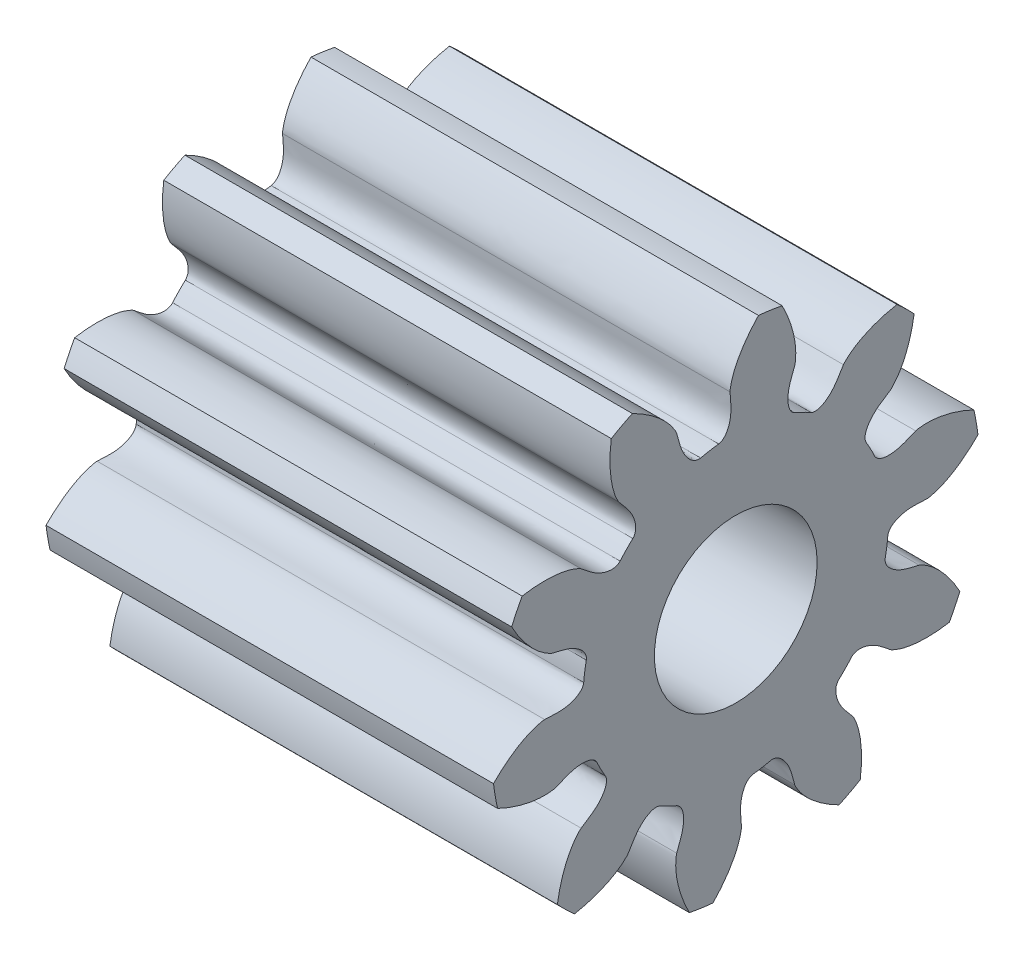
from build123d import *

# Parameters (mm, degrees)
ESQUISSE1_R        = 1
BOSS_EXTRU_1_DEPTH = 5.5


with BuildPart() as part:
    # Esquisse1 → Boss.-Extru.1 (new body)
    with BuildSketch(Plane(origin=(0, 0, 0), x_dir=(0, 0, -1), z_dir=(1, 0, 0))):
        with BuildLine():
            ThreePointArc((2.977310095, 0.368272455), (2.955741127, 0.513414445), (2.927100903, 0.657328154))
            add(Edge.make_bspline(
                [(2.211403727, 0.79214554), (2.222779445, 0.796220429), (2.274133198, 0.805614359), (2.359373738, 0.810478726), (2.538607422, 0.796225963), (2.732062921, 0.744216047), (2.878239296, 0.681280138), (2.927100903, 0.657328154)],
                knots=[0, 0, 0, 0, 0.036250587, 0.155621312, 0.255291203, 0.575254513, 0.744084786, 0.744084786, 0.744084786, 0.744084786], degree=3))
            add(Edge.make_bspline(
                [(2.211403727, 0.79214554), (2.132130324, 0.763749064), (1.99001212, 0.681956821), (1.750090704, 0.694113528), (1.707279056, 0.775127876)],
                knots=[0, 0, 0, 0, 0.252617676, 0.527509393, 0.527509393, 0.527509393, 0.527509393], degree=3))
            ThreePointArc((1.707279056, 0.775127876), (1.657764419, 0.876037746), (1.602292085, 0.973799299))
            add(Edge.make_bspline(
                [(1.90038092, 1.380707558), (1.832256922, 1.331212576), (1.684611138, 1.259880414), (1.559480437, 1.054813647), (1.602292085, 0.973799299)],
                knots=[0, 0, 0, 0, 0.252617676, 0.527509393, 0.527509393, 0.527509393, 0.527509393], degree=3))
            add(Edge.make_bspline(
                [(1.90038092, 1.380707558), (1.9101567, 1.387810078), (1.946851003, 1.424944725), (1.998895263, 1.49262786), (2.088102134, 1.648736761), (2.154127637, 1.837868182), (2.184488772, 1.994094501), (2.192229346, 2.04795764)],
                knots=[0, 0, 0, 0, 0.036250587, 0.155621312, 0.255291203, 0.575254513, 0.744084786, 0.744084786, 0.744084786, 0.744084786], degree=3))
            ThreePointArc((2.192229346, 2.04795764), (2.089467363, 2.152702055), (1.98170658, 2.25229639))
            add(Edge.make_bspline(
                [(1.32345173, 1.940689701), (1.33025972, 1.950672835), (1.366284165, 1.988457663), (1.432386008, 2.04249615), (1.585766668, 2.136316339), (1.772846116, 2.207949723), (1.928098087, 2.242953821), (1.98170658, 2.25229639)],
                knots=[0, 0, 0, 0, 0.036250587, 0.155621312, 0.255291203, 0.575254513, 0.744084786, 0.744084786, 0.744084786, 0.744084786], degree=3))
            add(Edge.make_bspline(
                [(1.32345173, 1.940689701), (1.27600923, 1.871120733), (1.209109462, 1.721414433), (1.007863426, 1.590227146), (0.925609036, 1.630605075)],
                knots=[0, 0, 0, 0, 0.252617676, 0.527509393, 0.527509393, 0.527509393, 0.527509393], degree=3))
            ThreePointArc((0.925609036, 1.630605075), (0.82623752, 1.683138901), (0.72389666, 1.729623839))
            add(Edge.make_bspline(
                [(0.72588092, 2.234031757), (0.699859868, 2.153947194), (0.622339913, 2.009454248), (0.641642271, 1.770001768), (0.72389666, 1.729623839)],
                knots=[0, 0, 0, 0, 0.252617676, 0.527509393, 0.527509393, 0.527509393, 0.527509393], degree=3))
            add(Edge.make_bspline(
                [(0.72588092, 2.234031757), (0.729614936, 2.245523876), (0.737474053, 2.297134806), (0.739795594, 2.382482461), (0.720206959, 2.561211698), (0.662454053, 2.753031049), (0.595189201, 2.897266624), (0.569791499, 2.945392614)],
                knots=[0, 0, 0, 0, 0.036250587, 0.155621312, 0.255291203, 0.575254513, 0.744084786, 0.744084786, 0.744084786, 0.744084786], degree=3))
            ThreePointArc((0.569791499, 2.945392614), (0.425088085, 2.969730648), (0.279367699, 2.986963958))
            add(Edge.make_bspline(
                [(-0.070013845, 2.347956359), (-0.070374004, 2.360034519), (-0.063438981, 2.411777724), (-0.041724492, 2.494349468), (0.027216945, 2.660406485), (0.136462351, 2.82832165), (0.241488941, 2.947895379), (0.279367699, 2.986963958)],
                knots=[0, 0, 0, 0, 0.036250587, 0.155621312, 0.255291203, 0.575254513, 0.744084786, 0.744084786, 0.744084786, 0.744084786], degree=3))
            add(Edge.make_bspline(
                [(-0.070013845, 2.347956359), (-0.06750402, 2.263787878), (-0.033631914, 2.103350241), (-0.119333425, 1.878928045), (-0.209612175, 1.863246558)],
                knots=[0, 0, 0, 0, 0.252617676, 0.527509393, 0.527509393, 0.527509393, 0.527509393], degree=3))
            ThreePointArc((-0.209612175, 1.863246558), (-0.320884028, 1.847338204), (-0.431002684, 1.824790861))
            add(Edge.make_bspline(
                [(-0.72588092, 2.234031757), (-0.699859868, 2.153947194), (-0.677644007, 1.991484859), (-0.521281435, 1.809109374), (-0.431002684, 1.824790861)],
                knots=[0, 0, 0, 0, 0.252617676, 0.527509393, 0.527509393, 0.527509393, 0.527509393], degree=3))
            add(Edge.make_bspline(
                [(-0.72588092, 2.234031757), (-0.729614936, 2.245523876), (-0.75359292, 2.291897469), (-0.801880846, 2.36230974), (-0.922782795, 2.495390819), (-1.082254463, 2.616629628), (-1.221452415, 2.693781371), (-1.270287335, 2.717787719)],
                knots=[0, 0, 0, 0, 0.036250587, 0.155621312, 0.255291203, 0.575254513, 0.744084786, 0.744084786, 0.744084786, 0.744084786], degree=3))
            ThreePointArc((-1.270287335, 2.717787719), (-1.401660393, 2.65242307), (-1.529680147, 2.580712818))
            add(Edge.make_bspline(
                [(-1.436736511, 1.858383491), (-1.44412725, 1.867943232), (-1.468930592, 1.913880668), (-1.499897654, 1.993446068), (-1.541728726, 2.168311777), (-1.552045394, 2.368370838), (-1.537360771, 2.526841097), (-1.529680147, 2.580712818)],
                knots=[0, 0, 0, 0, 0.036250587, 0.155621312, 0.255291203, 0.575254513, 0.744084786, 0.744084786, 0.744084786, 0.744084786], degree=3))
            add(Edge.make_bspline(
                [(-1.436736511, 1.858383491), (-1.385233029, 1.791764998), (-1.263527042, 1.681877747), (-1.200948963, 1.449942292), (-1.26476866, 1.384191185)],
                knots=[0, 0, 0, 0, 0.252617676, 0.527509393, 0.527509393, 0.527509393, 0.527509393], degree=3))
            ThreePointArc((-1.26476866, 1.384191185), (-1.345438785, 1.305917102), (-1.421273653, 1.222949796))
            add(Edge.make_bspline(
                [(-1.90038092, 1.380707558), (-1.832256922, 1.331212576), (-1.718790948, 1.212835941), (-1.48509335, 1.157198689), (-1.421273653, 1.222949796)],
                knots=[0, 0, 0, 0, 0.252617676, 0.527509393, 0.527509393, 0.527509393, 0.527509393], degree=3))
            add(Edge.make_bspline(
                [(-1.90038092, 1.380707558), (-1.9101567, 1.387810078), (-1.956813011, 1.411233197), (-2.037266059, 1.43981499), (-2.213300886, 1.476415463), (-2.413578559, 1.480764624), (-2.571540724, 1.461363192), (-2.625159582, 1.45208029)],
                knots=[0, 0, 0, 0, 0.036250587, 0.155621312, 0.255291203, 0.575254513, 0.744084786, 0.744084786, 0.744084786, 0.744084786], degree=3))
            ThreePointArc((-2.625159582, 1.45208029), (-2.693022242, 1.321980032), (-2.75444217, 1.188717096))
            add(Edge.make_bspline(
                [(-2.254674663, 0.658971294), (-2.266272971, 0.662361119), (-2.313340644, 0.684946248), (-2.385160892, 0.731114025), (-2.521786425, 0.847995669), (-2.64772455, 1.003782864), (-2.728990923, 1.140619401), (-2.75444217, 1.188717096)],
                knots=[0, 0, 0, 0, 0.036250587, 0.155621312, 0.255291203, 0.575254513, 0.744084786, 0.744084786, 0.744084786, 0.744084786], degree=3))
            add(Edge.make_bspline(
                [(-2.254674663, 0.658971294), (-2.173850103, 0.635348788), (-2.010797786, 0.617985118), (-1.823842817, 0.467127866), (-1.836826505, 0.376421826)],
                knots=[0, 0, 0, 0, 0.252617676, 0.527509393, 0.527509393, 0.527509393, 0.527509393], degree=3))
            ThreePointArc((-1.836826505, 0.376421826), (-1.856081655, 0.265680053), (-1.868666393, 0.153983476))
            add(Edge.make_bspline(
                [(-2.349, 0), (-2.264794108, 0), (-2.103418166, -0.029075083), (-1.881650081, 0.063277436), (-1.868666393, 0.153983476)],
                knots=[0, 0, 0, 0, 0.252617676, 0.527509393, 0.527509393, 0.527509393, 0.527509393], degree=3))
            add(Edge.make_bspline(
                [(-2.349, 0), (-2.361083529, 0), (-2.412597041, -0.00847419), (-2.494484881, -0.032640149), (-2.658413265, -0.106500419), (-2.822997679, -0.220702136), (-2.93938788, -0.329246056), (-2.977310095, -0.368272455)],
                knots=[0, 0, 0, 0, 0.036250587, 0.155621312, 0.255291203, 0.575254513, 0.744084786, 0.744084786, 0.744084786, 0.744084786], degree=3))
            ThreePointArc((-2.977310095, -0.368272455), (-2.955741127, -0.513414445), (-2.927100903, -0.657328154))
            add(Edge.make_bspline(
                [(-2.211403727, -0.79214554), (-2.222779445, -0.796220429), (-2.274133198, -0.805614359), (-2.359373738, -0.810478726), (-2.538607422, -0.796225963), (-2.732062921, -0.744216047), (-2.878239296, -0.681280138), (-2.927100903, -0.657328154)],
                knots=[0, 0, 0, 0, 0.036250587, 0.155621312, 0.255291203, 0.575254513, 0.744084786, 0.744084786, 0.744084786, 0.744084786], degree=3))
            add(Edge.make_bspline(
                [(-2.211403727, -0.79214554), (-2.132130324, -0.763749064), (-1.99001212, -0.681956821), (-1.750090704, -0.694113528), (-1.707279056, -0.775127876)],
                knots=[0, 0, 0, 0, 0.252617676, 0.527509393, 0.527509393, 0.527509393, 0.527509393], degree=3))
            ThreePointArc((-1.707279056, -0.775127876), (-1.657764419, -0.876037746), (-1.602292085, -0.973799299))
            add(Edge.make_bspline(
                [(-1.90038092, -1.380707558), (-1.832256922, -1.331212576), (-1.684611138, -1.259880414), (-1.559480437, -1.054813647), (-1.602292085, -0.973799299)],
                knots=[0, 0, 0, 0, 0.252617676, 0.527509393, 0.527509393, 0.527509393, 0.527509393], degree=3))
            add(Edge.make_bspline(
                [(-1.90038092, -1.380707558), (-1.9101567, -1.387810078), (-1.946851003, -1.424944725), (-1.998895263, -1.49262786), (-2.088102134, -1.648736761), (-2.154127637, -1.837868182), (-2.184488772, -1.994094501), (-2.192229346, -2.04795764)],
                knots=[0, 0, 0, 0, 0.036250587, 0.155621312, 0.255291203, 0.575254513, 0.744084786, 0.744084786, 0.744084786, 0.744084786], degree=3))
            ThreePointArc((-2.192229346, -2.04795764), (-2.089467363, -2.152702055), (-1.98170658, -2.25229639))
            add(Edge.make_bspline(
                [(-1.32345173, -1.940689701), (-1.33025972, -1.950672835), (-1.366284165, -1.988457663), (-1.432386008, -2.04249615), (-1.585766668, -2.136316339), (-1.772846116, -2.207949723), (-1.928098087, -2.242953821), (-1.98170658, -2.25229639)],
                knots=[0, 0, 0, 0, 0.036250587, 0.155621312, 0.255291203, 0.575254513, 0.744084786, 0.744084786, 0.744084786, 0.744084786], degree=3))
            add(Edge.make_bspline(
                [(-1.32345173, -1.940689701), (-1.27600923, -1.871120733), (-1.209109462, -1.721414433), (-1.007863426, -1.590227146), (-0.925609036, -1.630605075)],
                knots=[0, 0, 0, 0, 0.252617676, 0.527509393, 0.527509393, 0.527509393, 0.527509393], degree=3))
            ThreePointArc((-0.925609036, -1.630605075), (-0.82623752, -1.683138901), (-0.72389666, -1.729623839))
            add(Edge.make_bspline(
                [(-0.72588092, -2.234031757), (-0.699859868, -2.153947194), (-0.622339913, -2.009454248), (-0.641642271, -1.770001768), (-0.72389666, -1.729623839)],
                knots=[0, 0, 0, 0, 0.252617676, 0.527509393, 0.527509393, 0.527509393, 0.527509393], degree=3))
            add(Edge.make_bspline(
                [(-0.72588092, -2.234031757), (-0.729614936, -2.245523876), (-0.737474053, -2.297134806), (-0.739795594, -2.382482461), (-0.720206959, -2.561211698), (-0.662454053, -2.753031049), (-0.595189201, -2.897266624), (-0.569791499, -2.945392614)],
                knots=[0, 0, 0, 0, 0.036250587, 0.155621312, 0.255291203, 0.575254513, 0.744084786, 0.744084786, 0.744084786, 0.744084786], degree=3))
            ThreePointArc((-0.569791499, -2.945392614), (-0.425088085, -2.969730648), (-0.279367699, -2.986963958))
            add(Edge.make_bspline(
                [(0.070013845, -2.347956359), (0.070374004, -2.360034519), (0.063438981, -2.411777724), (0.041724492, -2.494349468), (-0.027216945, -2.660406485), (-0.136462351, -2.82832165), (-0.241488941, -2.947895379), (-0.279367699, -2.986963958)],
                knots=[0, 0, 0, 0, 0.036250587, 0.155621312, 0.255291203, 0.575254513, 0.744084786, 0.744084786, 0.744084786, 0.744084786], degree=3))
            add(Edge.make_bspline(
                [(0.070013845, -2.347956359), (0.06750402, -2.263787879), (0.033631914, -2.103350241), (0.119333425, -1.878928045), (0.209612175, -1.863246558)],
                knots=[0, 0, 0, 0, 0.252617676, 0.527509393, 0.527509393, 0.527509393, 0.527509393], degree=3))
            ThreePointArc((0.209612175, -1.863246558), (0.320884028, -1.847338204), (0.431002684, -1.824790861))
            add(Edge.make_bspline(
                [(0.72588092, -2.234031757), (0.699859868, -2.153947194), (0.677644007, -1.991484859), (0.521281435, -1.809109374), (0.431002684, -1.824790861)],
                knots=[0, 0, 0, 0, 0.252617676, 0.527509393, 0.527509393, 0.527509393, 0.527509393], degree=3))
            add(Edge.make_bspline(
                [(0.72588092, -2.234031757), (0.729614936, -2.245523876), (0.75359292, -2.291897469), (0.801880846, -2.36230974), (0.922782795, -2.495390819), (1.082254463, -2.616629628), (1.221452415, -2.693781371), (1.270287335, -2.717787719)],
                knots=[0, 0, 0, 0, 0.036250587, 0.155621312, 0.255291203, 0.575254513, 0.744084786, 0.744084786, 0.744084786, 0.744084786], degree=3))
            ThreePointArc((1.270287335, -2.717787719), (1.401660393, -2.65242307), (1.529680147, -2.580712818))
            add(Edge.make_bspline(
                [(1.436736511, -1.858383491), (1.44412725, -1.867943232), (1.468930592, -1.913880668), (1.499897654, -1.993446068), (1.541728726, -2.168311777), (1.552045394, -2.368370838), (1.537360771, -2.526841097), (1.529680147, -2.580712818)],
                knots=[0, 0, 0, 0, 0.036250587, 0.155621312, 0.255291203, 0.575254513, 0.744084786, 0.744084786, 0.744084786, 0.744084786], degree=3))
            add(Edge.make_bspline(
                [(1.436736511, -1.858383491), (1.385233029, -1.791764998), (1.263527042, -1.681877747), (1.200948963, -1.449942292), (1.26476866, -1.384191185)],
                knots=[0, 0, 0, 0, 0.252617676, 0.527509393, 0.527509393, 0.527509393, 0.527509393], degree=3))
            ThreePointArc((1.26476866, -1.384191185), (1.345438785, -1.305917102), (1.421273653, -1.222949796))
            add(Edge.make_bspline(
                [(1.90038092, -1.380707558), (1.832256922, -1.331212576), (1.718790948, -1.212835941), (1.48509335, -1.157198689), (1.421273653, -1.222949796)],
                knots=[0, 0, 0, 0, 0.252617676, 0.527509393, 0.527509393, 0.527509393, 0.527509393], degree=3))
            add(Edge.make_bspline(
                [(1.90038092, -1.380707558), (1.9101567, -1.387810078), (1.956813011, -1.411233197), (2.037266059, -1.43981499), (2.213300886, -1.476415463), (2.413578559, -1.480764624), (2.571540724, -1.461363192), (2.625159582, -1.45208029)],
                knots=[0, 0, 0, 0, 0.036250587, 0.155621312, 0.255291203, 0.575254513, 0.744084786, 0.744084786, 0.744084786, 0.744084786], degree=3))
            ThreePointArc((2.625159582, -1.45208029), (2.693022242, -1.321980032), (2.75444217, -1.188717096))
            add(Edge.make_bspline(
                [(2.254674663, -0.658971294), (2.266272971, -0.662361119), (2.313340644, -0.684946248), (2.385160892, -0.731114025), (2.521786425, -0.847995669), (2.64772455, -1.003782864), (2.728990923, -1.140619401), (2.75444217, -1.188717096)],
                knots=[0, 0, 0, 0, 0.036250587, 0.155621312, 0.255291203, 0.575254513, 0.744084786, 0.744084786, 0.744084786, 0.744084786], degree=3))
            add(Edge.make_bspline(
                [(2.254674663, -0.658971294), (2.173850103, -0.635348788), (2.010797786, -0.617985118), (1.823842817, -0.467127866), (1.836826505, -0.376421826)],
                knots=[0, 0, 0, 0, 0.252617676, 0.527509393, 0.527509393, 0.527509393, 0.527509393], degree=3))
            ThreePointArc((1.836826505, -0.376421826), (1.856081655, -0.265680053), (1.868666393, -0.153983476))
            add(Edge.make_bspline(
                [(2.349, 0), (2.264794108, 0), (2.103418166, 0.029075083), (1.881650081, -0.063277436), (1.868666393, -0.153983476)],
                knots=[0, 0, 0, 0, 0.252617676, 0.527509393, 0.527509393, 0.527509393, 0.527509393], degree=3))
            add(Edge.make_bspline(
                [(2.349, 0), (2.361083529, 0), (2.412597041, 0.00847419), (2.494484881, 0.032640149), (2.658413265, 0.106500419), (2.822997679, 0.220702136), (2.93938788, 0.329246056), (2.977310095, 0.368272455)],
                knots=[0, 0, 0, 0, 0.036250587, 0.155621312, 0.255291203, 0.575254513, 0.744084786, 0.744084786, 0.744084786, 0.744084786], degree=3))
        make_face()
        Circle(ESQUISSE1_R, mode=Mode.SUBTRACT)
    extrude(amount=BOSS_EXTRU_1_DEPTH)


solid = part.part
